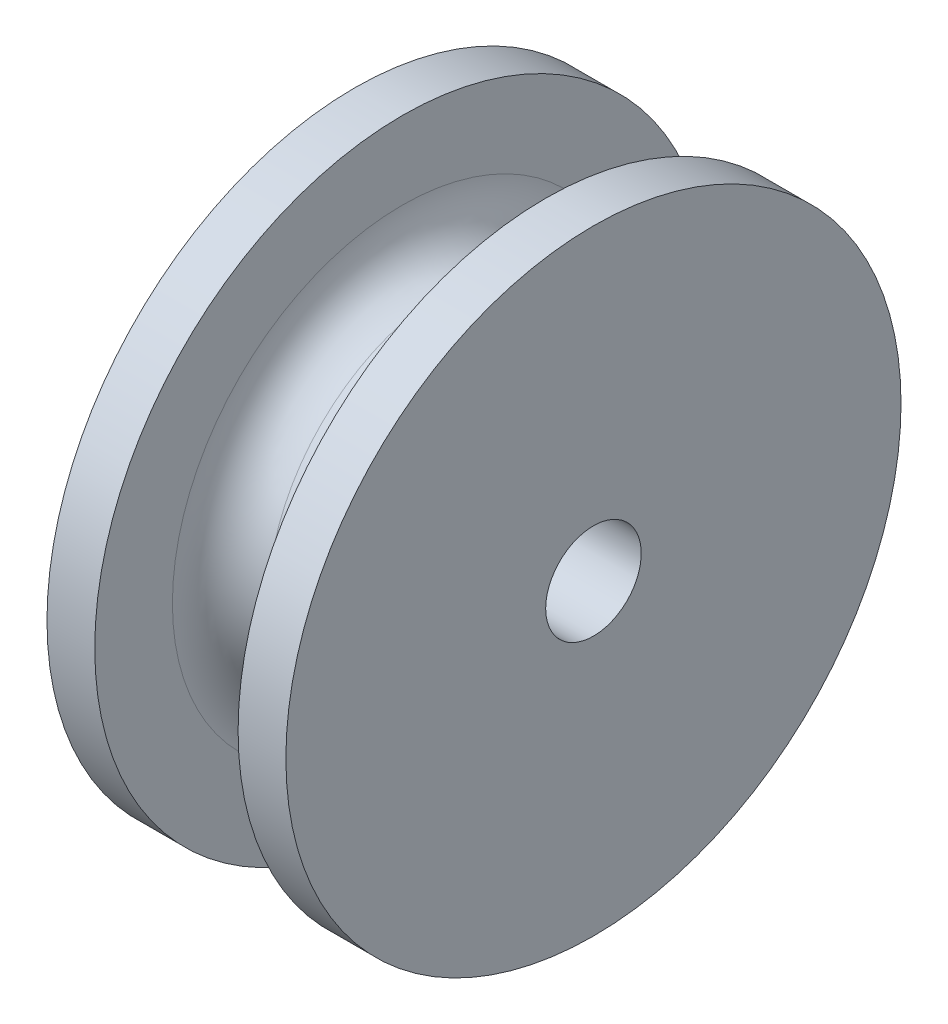
from build123d import *

# Parameters (mm, degrees)
FILLET1_R          = 4
SKETCH3_R          = 4
CUT_EXTRUDE1_DEPTH = 42.546660516


with BuildPart() as part:
    # Sketch1 → Revolve1 (revolve)
    with BuildSketch(Plane(origin=(0, 0, 0), x_dir=(-1, 0, 0), z_dir=(0, 1, 0)), mode=Mode.PRIVATE) as revolve1_sk:
        Polygon((-10, 0), (-10, 25.75), (-6, 25.75), (-6, 15.25), (6, 15.25), (6, 25.75), (10, 25.75), (10, 0), align=None)
    revolve(revolve1_sk.sketch.rotate(Axis((10, 0, 0), (-1, 0, 0)), 180), axis=Axis((10, 0, 0), (-1, 0, 0)))

    # Fillet1
    fillet1_edges = [part.edges().sort_by_distance(p)[0] for p in [
        (6, 0, 15.25),
        (-6, 0, 15.25),
    ]]
    fillet(fillet1_edges, radius=FILLET1_R)

    # Sketch3 → Cut-Extrude1 (cut, through all)
    with BuildSketch(Plane(origin=(-10, 0, 0), x_dir=(0, -1, 0), z_dir=(-1, 0, 0))):
        with Locations(Location((0, 0, 0), (0, 0, 90))):
            Circle(SKETCH3_R)
    extrude(amount=-CUT_EXTRUDE1_DEPTH, mode=Mode.SUBTRACT)


solid = part.part
